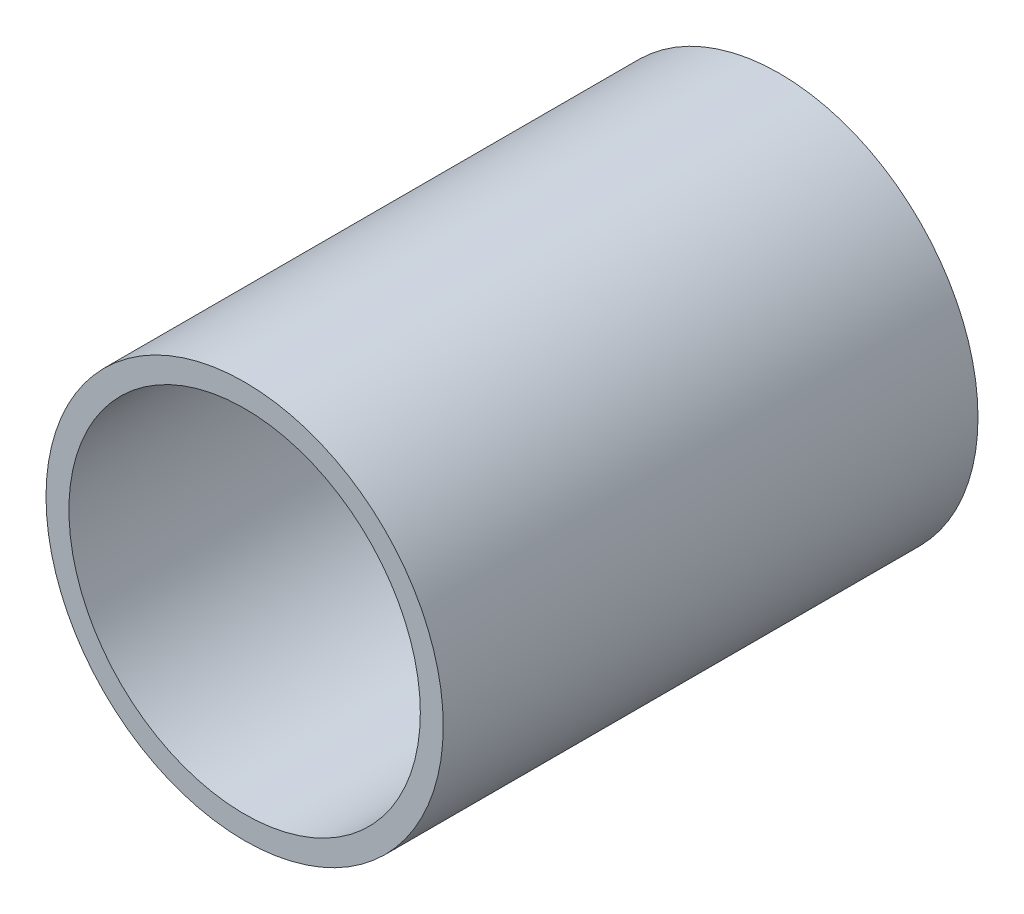
from build123d import *

# Parameters (mm, degrees)
SKETCH1_R           = 26
SKETCH1_R_2         = 23
BOSS_EXTRUDE1_DEPTH = 35


with BuildPart() as part:
    # Sketch1 → Boss-Extrude1 (new, symmetric)
    with BuildSketch(Plane.XY):
        Circle(SKETCH1_R)
        Circle(SKETCH1_R_2, mode=Mode.SUBTRACT)
    extrude(amount=BOSS_EXTRUDE1_DEPTH, both=True)


solid = part.part
